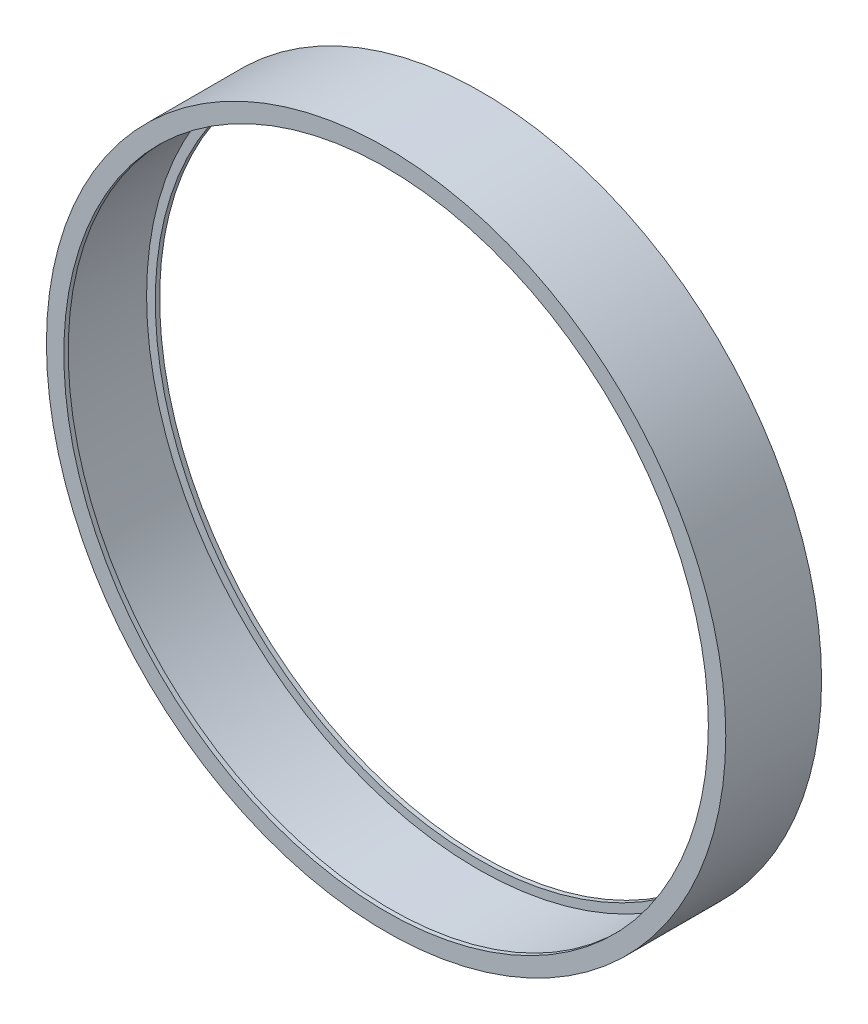
from build123d import *

# Parameters (mm, degrees)
SKETCH1_R           = 39
SKETCH1_R_2         = 37
BOSS_EXTRUDE1_DEPTH = 5.5
SKETCH1_7_R         = 38
SKETCH1_7_R_2       = 37
CUT_EXTRUDE1_DEPTH  = 5


with BuildPart() as part:
    # Sketch1 → Boss-Extrude1 (new, symmetric)
    with BuildSketch(Plane.XY):
        Circle(SKETCH1_R)
        Circle(SKETCH1_R_2, mode=Mode.SUBTRACT)
    extrude(amount=BOSS_EXTRUDE1_DEPTH, both=True)

    # Sketch1<7> → Cut-Extrude1 (cut, symmetric)
    with BuildSketch(Plane.XY):
        Circle(SKETCH1_7_R)
        Circle(SKETCH1_7_R_2, mode=Mode.SUBTRACT)
    extrude(amount=CUT_EXTRUDE1_DEPTH, both=True, mode=Mode.SUBTRACT)


solid = part.part
